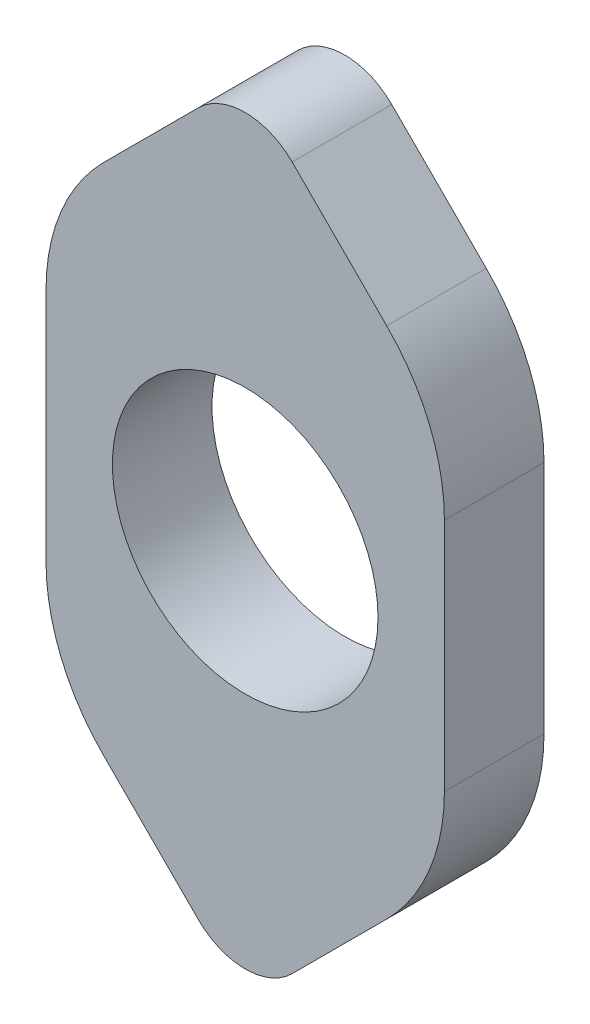
from build123d import *

# Parameters (mm, degrees)
SKETCH_1_R      = 2
EXTRUDE_1_DEPTH = 0.75


with BuildPart() as part:
    # Эскиз1 → Бобышка-Вытянуть1 (new, symmetric)
    with BuildSketch(Plane.XY):
        with BuildLine():
            Line((-1.837638241, 9.854632004), (-1.837638241, 6.314293406))
            ThreePointArc((-1.837638241, 6.314293406), (-1.611630943, 5.178077993), (-0.968016612, 4.214841076))
            Line((-0.968016612, 4.214841076), (0.455254978, 2.791569486))
            ThreePointArc((0.455254978, 2.791569486), (1.162361759, 2.498676267), (1.869468541, 2.791569486))
            Line((1.869468541, 2.791569486), (3.292740131, 4.214841076))
            ThreePointArc((3.292740131, 4.214841076), (3.936354462, 5.178077993), (4.162361759, 6.314293406))
            Line((4.162361759, 6.314293406), (4.162361759, 9.854632004))
            ThreePointArc((4.162361759, 9.854632004), (3.936354462, 10.990847417), (3.292740131, 11.954084334))
            Line((3.292740131, 11.954084334), (1.869468541, 13.377355924))
            ThreePointArc((1.869468541, 13.377355924), (1.162361759, 13.670249143), (0.455254978, 13.377355924))
            Line((0.455254978, 13.377355924), (-0.968016612, 11.954084334))
            ThreePointArc((-0.968016612, 11.954084334), (-1.611630943, 10.990847417), (-1.837638241, 9.854632004))
        make_face()
        with Locations((1.162361759, 8.084462705)):
            Circle(SKETCH_1_R, mode=Mode.SUBTRACT)
    extrude(amount=EXTRUDE_1_DEPTH, both=True)


solid = part.part
